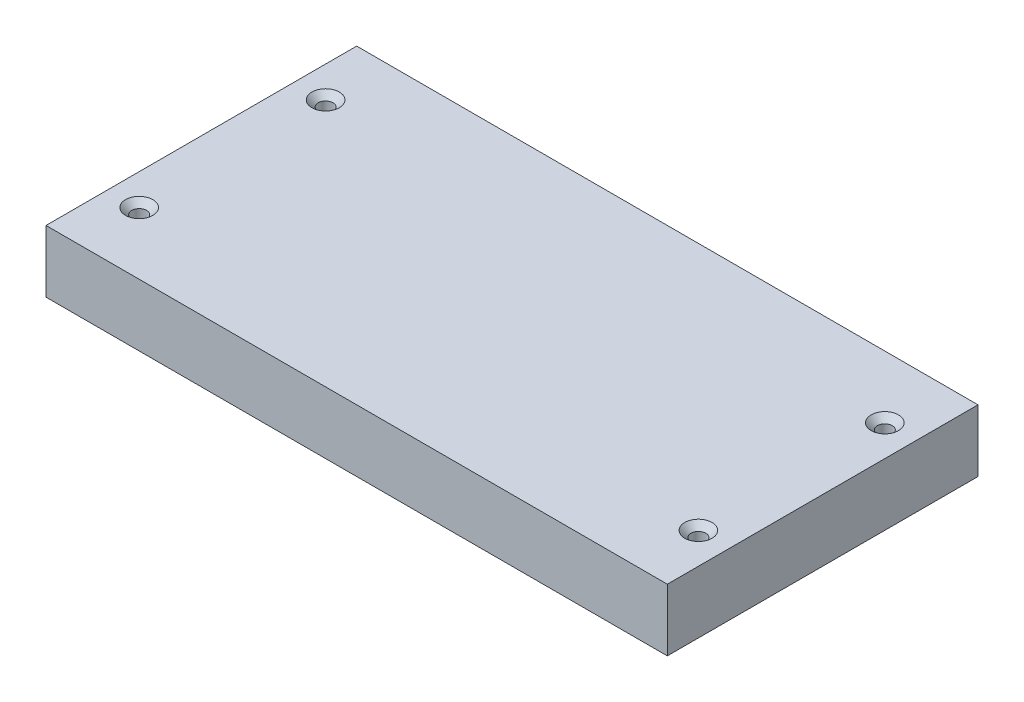
from build123d import *

# Parameters (mm, degrees)
SKETCH1_W                                       = 100
SKETCH1_H                                       = 50
BOSS_EXTRUDE1_DEPTH                             = 10
CSK_FOR_M2_FLAT_HEAD_MACHINE_SCREW1_D           = 2.4
CSK_FOR_M2_FLAT_HEAD_MACHINE_SCREW1_CSINK_D     = 4.4
CSK_FOR_M2_FLAT_HEAD_MACHINE_SCREW1_CSINK_ANGLE = 90


with BuildPart() as part:
    # Sketch1 → Boss-Extrude1 (new body)
    with BuildSketch(Plane(origin=(0, 0, 0), x_dir=(1, 0, 0), z_dir=(0, 1, 0))):
        Rectangle(SKETCH1_W, SKETCH1_H)
    extrude(amount=BOSS_EXTRUDE1_DEPTH)

    # CSK for M2 Flat Head Machine Screw1 (through all)
    with Locations(Plane(origin=(-45, 10, -15), x_dir=(0, 0, 1), z_dir=(0, 1, 0))):
        with Locations((0, 0), (0, 90), (30, 90), (30, 0)):
            CounterSinkHole(CSK_FOR_M2_FLAT_HEAD_MACHINE_SCREW1_D / 2, CSK_FOR_M2_FLAT_HEAD_MACHINE_SCREW1_CSINK_D / 2, counter_sink_angle=CSK_FOR_M2_FLAT_HEAD_MACHINE_SCREW1_CSINK_ANGLE)


solid = part.part
